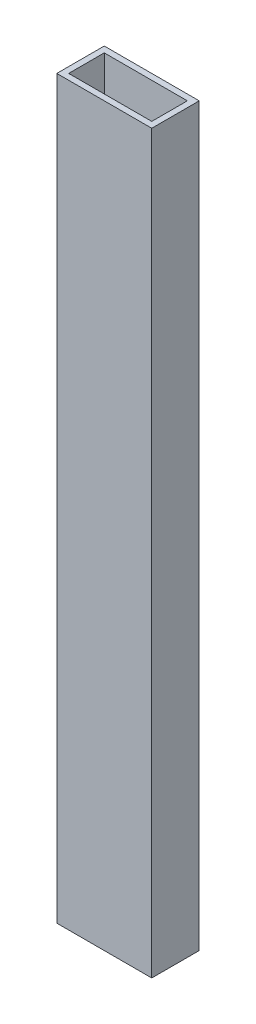
from build123d import *

# Parameters (mm, degrees)
SKETCH1_W           = 50.8
SKETCH1_H           = 25.4
SKETCH1_W_2         = 44.45
SKETCH1_H_2         = 19.05
BOSS_EXTRUDE1_DEPTH = 196.85


with BuildPart() as part:
    # Sketch1 → Boss-Extrude1 (new, symmetric)
    with BuildSketch(Plane(origin=(0, 0, 0), x_dir=(1, 0, 0), z_dir=(0, 1, 0))):
        Rectangle(SKETCH1_W, SKETCH1_H)
        Rectangle(SKETCH1_W_2, SKETCH1_H_2, mode=Mode.SUBTRACT)
    extrude(amount=BOSS_EXTRUDE1_DEPTH, both=True)


solid = part.part
